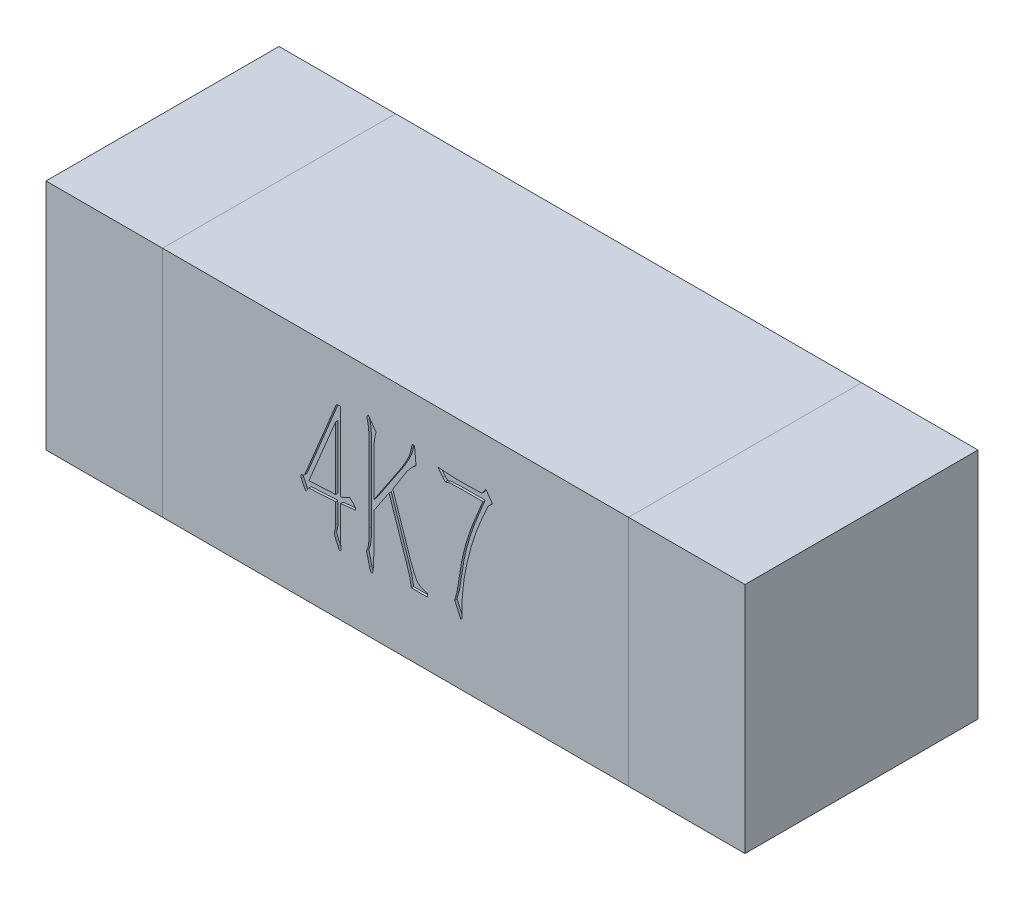
from build123d import *

# Parameters (mm, degrees)
SKETCH_1_W          = 2
SKETCH_1_H          = 1
EXTRUDE_1_DEPTH     = 1
SKETCH_2_W          = 0.5
SKETCH_2_H          = 1
EXTRUDE_2_DEPTH     = 1
EXTRUDE_2_2_DEPTH   = 1
CUT_EXTRUDE_1_DEPTH = 0.01


with BuildPart() as part:
    # 草图1 → 凸台-拉伸1 (new body)
    with BuildSketch(Plane.XY):
        Rectangle(SKETCH_1_W, SKETCH_1_H)
    extrude(amount=EXTRUDE_1_DEPTH)

    # 草图4 → 切除-拉伸1 (cut)
    # profile 1 of 3: a face of its own
    with BuildSketch(Plane.XY.offset(1)):
        with BuildLine():
            Line((-0.257910983, -0.070699743), (-0.372411539, -0.077194522))
            Line((-0.372411539, -0.077194522), (-0.380469877, -0.089342165))
            add(Edge.make_bspline(
                [(-0.380469877, -0.089342165), (-0.380995729, -0.090615148), (-0.381790454, -0.092539021), (-0.384728757, -0.094523091), (-0.386933067, -0.091677111), (-0.387974697, -0.089821104), (-0.388648488, -0.088620523)],
                knots=[0, 0, 0, 0, 1.282902353, 1.938863145, 2.666728425, 4, 4, 4, 4], degree=3))
            Line((-0.388648488, -0.088620523), (-0.40404352, -0.057710184))
            add(Edge.make_bspline(
                [(-0.40404352, -0.057710184), (-0.404702113, -0.055884875), (-0.405788124, -0.05287496), (-0.406578781, -0.048834921), (-0.406353976, -0.04598555), (-0.405832195, -0.044513716), (-0.405607079, -0.043878709)],
                knots=[0, 0, 0, 0, 1.63130738, 2.690008936, 3.434818089, 4, 4, 4, 4], degree=3))
            Line((-0.405607079, -0.043878709), (-0.399112299, -0.042315151))
            Line((-0.399112299, -0.042315151), (-0.390212046, -0.037383929))
            Line((-0.390212046, -0.037383929), (-0.252979761, 0.293849823))
            Line((-0.252979761, 0.293849823), (-0.235179255, 0.293849823))
            Line((-0.235179255, 0.293849823), (-0.235179255, -0.040631319))
            add(Edge.make_bspline(
                [(-0.235179255, -0.040631319), (-0.233506637, -0.040644), (-0.230662551, -0.040665563), (-0.228068941, -0.039533892), (-0.227000643, -0.039067761)],
                knots=[0, 0, 0, 0, 1.176207474, 2, 2, 2, 2], degree=3))
            Line((-0.227000643, -0.039067761), (-0.214853, -0.03413654))
            add(Edge.make_bspline(
                [(-0.214853, -0.03413654), (-0.213282612, -0.03355043), (-0.210483444, -0.032505708), (-0.206879154, -0.030936727), (-0.204327662, -0.029728683), (-0.203138788, -0.028816304), (-0.202705357, -0.028483676)],
                knots=[0, 0, 0, 0, 1.495147538, 2.665053038, 3.513315187, 4, 4, 4, 4], degree=3))
            Line((-0.202705357, -0.028483676), (-0.197052494, -0.023672728))
            Line((-0.197052494, -0.023672728), (-0.174320766, -0.047126099))
            add(Edge.make_bspline(
                [(-0.174320766, -0.047126099), (-0.173162728, -0.048519716), (-0.171267067, -0.050801011), (-0.170439691, -0.054661645), (-0.171228715, -0.057272477), (-0.172703695, -0.059152646), (-0.175274735, -0.059940764), (-0.177167217, -0.060050541), (-0.178289797, -0.060115658)],
                knots=[0, 0, 0, 0, 1.690587597, 2.767423091, 3.557953073, 4.202677464, 4.933866242, 6, 6, 6, 6], degree=3))
            Line((-0.178289797, -0.060115658), (-0.235179255, -0.066610437))
            Line((-0.235179255, -0.066610437), (-0.235179255, -0.212021333))
            add(Edge.make_bspline(
                [(-0.235179255, -0.212021333), (-0.23518215, -0.212462393), (-0.235191894, -0.21394673), (-0.235005073, -0.217071449), (-0.234929318, -0.222043407), (-0.234831834, -0.22822169), (-0.234664884, -0.23442113), (-0.234718824, -0.239442349), (-0.235044292, -0.24260878), (-0.235809788, -0.244643738), (-0.237308221, -0.245008111), (-0.238077339, -0.244655413), (-0.238426644, -0.24449523)],
                knots=[0, 0, 0, 0, 0.375701713, 1.264380521, 2.665139726, 4.612257271, 6.525225464, 7.960129458, 8.858599367, 9.286556546, 9.675980055, 10, 10, 10, 10], degree=3))
            add(Edge.make_bspline(
                [(-0.238426644, -0.24449523), (-0.239105728, -0.244091591), (-0.241152852, -0.242874808), (-0.242947005, -0.238948116), (-0.245102796, -0.234872441), (-0.246071926, -0.231921488), (-0.246484982, -0.230663755)],
                knots=[0, 0, 0, 0, 0.572299195, 1.725216547, 3.030459198, 4, 4, 4, 4], degree=3))
            Line((-0.246484982, -0.230663755), (-0.253821677, -0.215990365))
            Line((-0.253821677, -0.215990365), (-0.257910983, -0.204684637))
            add(Edge.make_bspline(
                [(-0.257910983, -0.204684637), (-0.25853285, -0.203329813), (-0.259658132, -0.200878231), (-0.260890808, -0.19749889), (-0.261991398, -0.195004034), (-0.262604068, -0.192035916), (-0.261885388, -0.187399188), (-0.260301459, -0.180905875), (-0.258399244, -0.173964354), (-0.257505512, -0.167621356), (-0.257138609, -0.162153179), (-0.257092579, -0.158620345), (-0.257069067, -0.156815707)],
                knots=[0, 0, 0, 0, 0.908031708, 1.643101311, 2.192199313, 2.565975908, 3.473020803, 5.002279505, 6.661670863, 7.846934984, 8.900174221, 10, 10, 10, 10], degree=3))
            Line((-0.257069067, -0.156815707), (-0.257910983, -0.070699743))
        make_face()
        Polygon((-0.257069067, -0.043878709), (-0.257069067, 0.225654639), (-0.371569623, -0.049651846), align=None, mode=Mode.SUBTRACT)
    # profile 2 of 3: a face of its own
    with BuildSketch(Plane.XY.offset(1)):
        with BuildLine():
            Line((-0.092053559, 0.02022717), (0.027257945, 0.198833605))
            add(Edge.make_bspline(
                [(0.027257945, 0.198833605), (0.027980185, 0.199995846), (0.029841933, 0.202991805), (0.033217327, 0.20847324), (0.037513447, 0.216157888), (0.042720244, 0.225278299), (0.048131766, 0.234835474), (0.052817471, 0.243766514), (0.056435986, 0.251542945), (0.060346046, 0.260507946), (0.064030054, 0.272306536), (0.066003616, 0.282080874), (0.067068538, 0.287355043)],
                knots=[0, 0, 0, 0, 0.420080696, 1.08285973, 1.975895696, 3.122344224, 4.307000813, 5.347403028, 6.217326357, 6.939704131, 8.348684182, 10, 10, 10, 10], degree=3))
            Line((0.067068538, 0.287355043), (0.071157843, 0.306839382))
            Line((0.071157843, 0.306839382), (0.081741928, 0.306839382))
            Line((0.081741928, 0.306839382), (0.088236708, 0.234554892))
            add(Edge.make_bspline(
                [(0.088236708, 0.234554892), (0.086168868, 0.233224449), (0.0822251, 0.23068704), (0.077572063, 0.227038746), (0.073737227, 0.22380402), (0.070561597, 0.220315324), (0.066567806, 0.216168872), (0.060686134, 0.209610468), (0.0534575, 0.201245661), (0.048413793, 0.194063028), (0.046020641, 0.190654994)],
                knots=[0, 0, 0, 0, 0.961837198, 1.834408076, 2.312695353, 2.923075551, 3.677929009, 4.566716946, 6.370966884, 8, 8, 8, 8], degree=3))
            Line((0.046020641, 0.190654994), (-0.011710732, 0.099006439))
            Line((-0.011710732, 0.099006439), (0.067910454, -0.136489453))
            add(Edge.make_bspline(
                [(0.067910454, -0.136489453), (0.068414885, -0.138059012), (0.069591506, -0.141720117), (0.072058297, -0.147781457), (0.075200514, -0.155271761), (0.078838058, -0.163655973), (0.082539335, -0.17204827), (0.086233557, -0.179286791), (0.089043657, -0.185279655), (0.092377092, -0.191343647), (0.097704451, -0.197768201), (0.105960614, -0.203687314), (0.115033604, -0.208662279), (0.121588872, -0.21037288), (0.124679637, -0.211179417)],
                knots=[0, 0, 0, 0, 0.601283206, 1.402534455, 2.385877248, 3.565090634, 4.736842296, 5.731110854, 6.529151735, 7.151416212, 8.252576758, 9.536782906, 10.838609505, 12, 12, 12, 12], degree=3))
            Line((0.124679637, -0.211179417), (0.136947554, -0.214426807))
            Line((0.136947554, -0.214426807), (0.136947554, -0.228258281))
            Line((0.136947554, -0.228258281), (0.067910454, -0.228258281))
            add(Edge.make_bspline(
                [(0.067910454, -0.228258281), (0.067339071, -0.225132886), (0.066153678, -0.218648923), (0.064544927, -0.208726975), (0.062861293, -0.198703679), (0.060922472, -0.190044345), (0.058662473, -0.181833192), (0.05581928, -0.172966986), (0.052132573, -0.161273998), (0.049205687, -0.152600356), (0.047584199, -0.14779518)],
                knots=[0, 0, 0, 0, 0.916910572, 1.902227753, 2.90090532, 3.849675465, 4.461593695, 5.358203872, 6.536451397, 8, 8, 8, 8], degree=3))
            Line((0.047584199, -0.14779518), (-0.02794768, 0.076274711))
            Line((-0.02794768, 0.076274711), (-0.092053559, -0.020425339))
            Line((-0.092053559, -0.020425339), (-0.092053559, -0.160784739))
            Line((-0.092053559, -0.160784739), (-0.094459033, -0.219237754))
            add(Edge.make_bspline(
                [(-0.094459033, -0.219237754), (-0.094595315, -0.222647121), (-0.094847309, -0.228951229), (-0.09553829, -0.237657663), (-0.096507764, -0.244851957), (-0.097491088, -0.250534038), (-0.098767154, -0.254784977), (-0.099604499, -0.25737911), (-0.100609645, -0.259387839), (-0.101499945, -0.259133009), (-0.101795728, -0.259048347)],
                knots=[0, 0, 0, 0, 1.962828299, 3.629378072, 5.025620302, 6.129446706, 6.969082562, 7.509057143, 7.836894713, 8, 8, 8, 8], degree=3))
            add(Edge.make_bspline(
                [(-0.101795728, -0.259048347), (-0.102159844, -0.258939141), (-0.103057166, -0.258670014), (-0.104868713, -0.257651476), (-0.106755909, -0.254396161), (-0.108871987, -0.249717168), (-0.110843002, -0.244488229), (-0.111338627, -0.240976097), (-0.111537897, -0.239564009)],
                knots=[0, 0, 0, 0, 0.30186791, 0.743920916, 1.609509567, 3.189637424, 4.870065584, 6, 6, 6, 6], degree=3))
            Line((-0.111537897, -0.239564009), (-0.118874593, -0.210337501))
            add(Edge.make_bspline(
                [(-0.118874593, -0.210337501), (-0.119742521, -0.20733948), (-0.121253708, -0.202119501), (-0.122877101, -0.195368937), (-0.123982769, -0.191008663), (-0.124783155, -0.187747476), (-0.123514011, -0.184100481), (-0.121735855, -0.179274003), (-0.119237505, -0.173846521), (-0.117502149, -0.167902758), (-0.116094842, -0.160992792), (-0.115073531, -0.152381472), (-0.114138775, -0.142716764), (-0.113631122, -0.134168026), (-0.113278908, -0.126429419), (-0.113230636, -0.118608416), (-0.113057525, -0.108746955), (-0.113085923, -0.101489946), (-0.113101455, -0.097520776)],
                knots=[0, 0, 0, 0, 1.303234359, 2.269115785, 2.890039559, 3.195386403, 3.64187597, 4.446796483, 5.369688572, 6.121366675, 7.027109972, 8.309771923, 9.738354317, 11.079598601, 11.883474893, 12.971242357, 14.343442508, 16, 16, 16, 16], degree=3))
            Line((-0.113101455, -0.097520776), (-0.113101455, 0.219159859))
            add(Edge.make_bspline(
                [(-0.113101455, 0.219159859), (-0.113083212, 0.221365179), (-0.11304406, 0.226097866), (-0.113385093, 0.233671859), (-0.113564217, 0.242254287), (-0.113935226, 0.251475125), (-0.114337173, 0.260542632), (-0.115009919, 0.2686324), (-0.115476463, 0.275395742), (-0.116690608, 0.282603034), (-0.118214345, 0.290799842), (-0.119692064, 0.297142337), (-0.120438151, 0.300344602)],
                knots=[0, 0, 0, 0, 0.809324544, 1.736836047, 2.782014883, 3.960041647, 5.124015164, 6.112661131, 6.939978743, 7.610116978, 8.79337068, 10, 10, 10, 10], degree=3))
            Line((-0.120438151, 0.300344602), (-0.123685541, 0.313334161))
            Line((-0.123685541, 0.313334161), (-0.116348845, 0.321392499))
            Line((-0.116348845, 0.321392499), (-0.083153306, 0.273523569))
            add(Edge.make_bspline(
                [(-0.083153306, 0.273523569), (-0.08411453, 0.270891131), (-0.085816368, 0.266230429), (-0.08743567, 0.260417446), (-0.088282948, 0.255809872), (-0.089008915, 0.251565993), (-0.089680718, 0.246220294), (-0.090936985, 0.237357409), (-0.091904043, 0.224391164), (-0.092001365, 0.213548661), (-0.092053559, 0.207733858)],
                knots=[0, 0, 0, 0, 1.007435709, 1.783654327, 2.165285696, 2.691347983, 3.331434253, 4.102011478, 5.909520124, 8, 8, 8, 8], degree=3))
            Line((-0.092053559, 0.207733858), (-0.092053559, 0.02022717))
        make_face()
    # profile 3 of 3: a face of its own
    with BuildSketch(Plane.XY.offset(1)):
        with BuildLine():
            add(Edge.make_bspline(
                [(0.374969193, 0.245860619), (0.36923624, 0.245945405), (0.358251779, 0.246107858), (0.342575731, 0.246267321), (0.328422918, 0.246148102), (0.315874601, 0.246435244), (0.30489005, 0.246168457), (0.295468108, 0.24625446), (0.287607794, 0.246152614), (0.282879343, 0.245949957), (0.280794891, 0.245860619)],
                knots=[0, 0, 0, 0, 1.461051911, 2.799406174, 3.994695385, 5.067439477, 5.997164994, 6.794024468, 7.468367567, 8, 8, 8, 8], degree=3))
            Line((0.280794891, 0.245860619), (0.241826215, 0.244297061))
            add(Edge.make_bspline(
                [(0.241826215, 0.244297061), (0.238961137, 0.244319738), (0.23403199, 0.244358752), (0.229268006, 0.243128426), (0.227273098, 0.242613229)],
                knots=[0, 0, 0, 0, 1.16250452, 2, 2, 2, 2], degree=3))
            Line((0.227273098, 0.242613229), (0.219094486, 0.23936584))
            add(Edge.make_bspline(
                [(0.219094486, 0.23936584), (0.218170571, 0.239164764), (0.216559034, 0.238814038), (0.214964083, 0.239200809), (0.214283539, 0.23936584)],
                knots=[0, 0, 0, 0, 1.146626707, 2, 2, 2, 2], degree=3))
            add(Edge.make_bspline(
                [(0.214283539, 0.23936584), (0.21362133, 0.239697956), (0.21191301, 0.240554726), (0.209495602, 0.243225809), (0.206223838, 0.246853402), (0.204065171, 0.249918842), (0.202857538, 0.251633756)],
                knots=[0, 0, 0, 0, 0.522008364, 1.346640983, 2.515617707, 4, 4, 4, 4], degree=3))
            Line((0.202857538, 0.251633756), (0.185898947, 0.271118095))
            add(Edge.make_bspline(
                [(0.185898947, 0.271118095), (0.185255397, 0.271994599), (0.184270384, 0.27333617), (0.183067105, 0.275397202), (0.184100197, 0.2770357), (0.185200551, 0.277388776), (0.185898947, 0.277612874)],
                knots=[0, 0, 0, 0, 1.576958087, 2.413680609, 2.993160347, 4, 4, 4, 4], degree=3))
            Line((0.185898947, 0.277612874), (0.202135896, 0.275929043))
            Line((0.202135896, 0.275929043), (0.230520487, 0.274365485))
            add(Edge.make_bspline(
                [(0.230520487, 0.274365485), (0.237213633, 0.27388704), (0.249910384, 0.272979442), (0.267998306, 0.272263558), (0.284047803, 0.272046908), (0.294065875, 0.272480435), (0.298715672, 0.272681653)],
                knots=[0, 0, 0, 0, 1.17952993, 2.237542501, 3.181971475, 4, 4, 4, 4], degree=3))
            Line((0.298715672, 0.272681653), (0.371000162, 0.274365485))
            Line((0.371000162, 0.274365485), (0.387958752, 0.298660771))
            Line((0.387958752, 0.298660771), (0.416463618, 0.25728662))
            Line((0.416463618, 0.25728662), (0.396979279, 0.23936584))
            add(Edge.make_bspline(
                [(0.396979279, 0.23936584), (0.396111073, 0.237235189), (0.394517749, 0.233325044), (0.392128081, 0.228013543), (0.390415049, 0.223588839), (0.389010778, 0.220358365), (0.387835012, 0.217678012), (0.386634758, 0.214910597), (0.385032292, 0.211221774), (0.383047936, 0.206584309), (0.380460952, 0.201114732), (0.377737887, 0.194645419), (0.37446737, 0.187318715), (0.369597957, 0.176538103), (0.363639973, 0.162949302), (0.357230591, 0.147163528), (0.351260124, 0.132672151), (0.344408375, 0.114520187), (0.336636413, 0.091508124), (0.327544278, 0.062412177), (0.318690523, 0.030534602), (0.309640109, -0.003868062), (0.301585388, -0.040409972), (0.295862132, -0.071581886), (0.292209939, -0.096414216), (0.289861423, -0.114288135), (0.288255269, -0.131387422), (0.2868703, -0.147539317), (0.286064772, -0.162622831), (0.285566836, -0.176456138), (0.285400538, -0.188970506), (0.285621697, -0.196867123), (0.285726113, -0.200595332)],
                knots=[0, 0, 0, 0, 0.452499367, 0.830421745, 1.145244612, 1.385457386, 1.523169464, 1.720933553, 1.978750205, 2.31422616, 2.712964021, 3.168544679, 3.694564508, 4.291044716, 5.495236599, 6.612541028, 7.641936826, 8.577774526, 10.428066285, 12.41833758, 14.572718391, 16.934712686, 19.414194725, 21.930665941, 23.166281125, 24.350715242, 25.475866727, 26.54391973, 27.539008514, 28.446374518, 29.266490973, 30, 30, 30, 30], degree=3))
            Line((0.285726113, -0.200595332), (0.285726113, -0.235474703))
            Line((0.285726113, -0.235474703), (0.280073249, -0.238722093))
            Line((0.280073249, -0.238722093), (0.254094131, -0.181110993))
            add(Edge.make_bspline(
                [(0.254094131, -0.181110993), (0.254592018, -0.179552187), (0.255468751, -0.176807274), (0.256405746, -0.173180216), (0.257042134, -0.170700127), (0.257265357, -0.169405188), (0.257341521, -0.16896335)],
                knots=[0, 0, 0, 0, 1.560097851, 2.74718673, 3.572535822, 4, 4, 4, 4], degree=3))
            Line((0.257341521, -0.16896335), (0.263836301, -0.146231622))
            add(Edge.make_bspline(
                [(0.263836301, -0.146231622), (0.264682152, -0.141421374), (0.266485694, -0.131164869), (0.269272203, -0.114817036), (0.272131536, -0.096483998), (0.275102794, -0.076947849), (0.278151775, -0.057710813), (0.280827533, -0.04032949), (0.283413502, -0.02563252), (0.285658262, -0.012691745), (0.288390452, 0.000272724), (0.292038603, 0.014971815), (0.296648996, 0.032322026), (0.301959823, 0.051677265), (0.307977629, 0.071687968), (0.31387726, 0.091196367), (0.32005143, 0.10932367), (0.324237936, 0.120942068), (0.326258348, 0.126549115)],
                knots=[0, 0, 0, 0, 0.835904569, 1.782332284, 2.838215692, 4.011468279, 5.164379694, 6.171749793, 7.021175418, 7.718362152, 8.4194883, 9.288205322, 10.310099412, 11.492047838, 12.723030323, 13.886349048, 14.979950486, 16, 16, 16, 16], degree=3))
            Line((0.326258348, 0.126549115), (0.355484855, 0.198833605))
            Line((0.355484855, 0.198833605), (0.374969193, 0.245860619))
        make_face()
    extrude(amount=-CUT_EXTRUDE_1_DEPTH, mode=Mode.SUBTRACT)


with BuildPart() as body_2:
    # 草图2 → 凸台-拉伸2 (new body)
    with BuildSketch(Plane(origin=(0, 0, 0), x_dir=(-1, 0, 0), z_dir=(0, 0, -1))):
        with Locations((1.25, 0)):
            Rectangle(SKETCH_2_W, SKETCH_2_H)
    extrude(amount=-EXTRUDE_2_DEPTH)


with BuildPart() as body_3:
    # 草图2 → Extrude 2 2 (new body)
    with BuildSketch(Plane(origin=(0, 0, 0), x_dir=(-1, 0, 0), z_dir=(0, 0, -1))):
        with Locations((-1.25, 0)):
            Rectangle(SKETCH_2_W, SKETCH_2_H)
    extrude(amount=-EXTRUDE_2_2_DEPTH)


solid = Compound([part.part, body_2.part, body_3.part])
